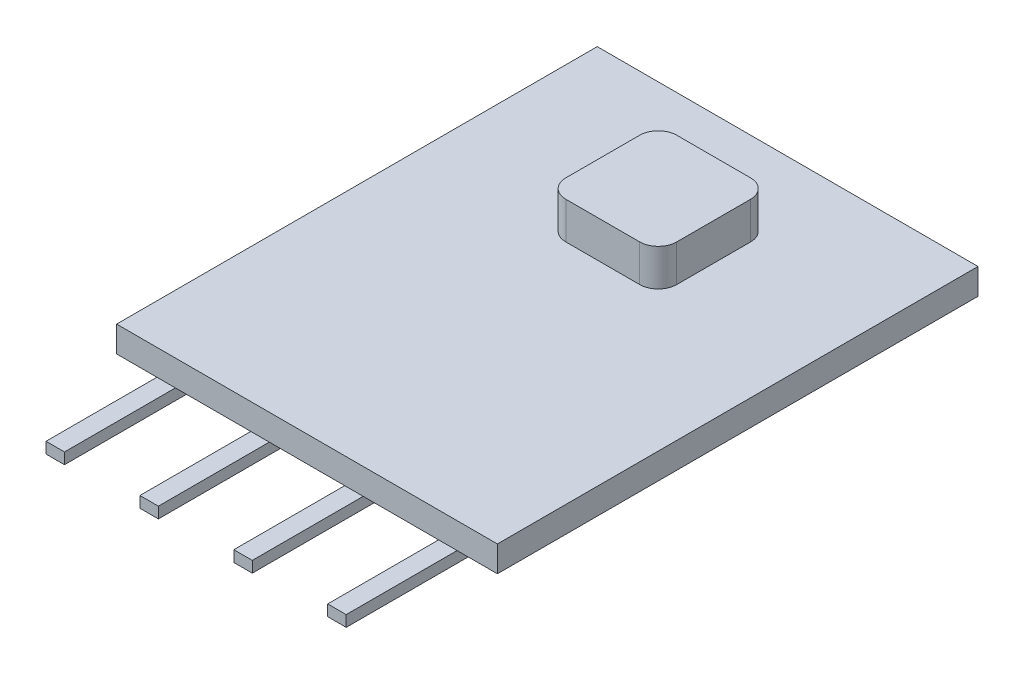
from build123d import *

# Parameters (mm, degrees)
SKETCH_1_W             = 10.3
SKETCH_1_H             = 13
EXTRUDE_1_DEPTH        = 0.7
SKETCH_2_W             = 3
SKETCH_2_H             = 3
EXTRUDE_2_DEPTH        = 1
FILLET_1_R             = 0.5
SKETCH_3_W             = 0.5
SKETCH_3_H             = 0.5
EXTRUDE_3_DEPTH        = 0.3
SKETCH_4_W             = 0.5
SKETCH_4_H             = 0.3
EXTRUDE_4_DEPTH        = 3
PATTERN_LINEAR_1_COUNT = 4
PATTERN_LINEAR_1_PITCH = 2.54


with BuildPart() as part:
    # Эскиз1 → Бобышка-Вытянуть1 (new body)
    with BuildSketch(Plane(origin=(0, 0, 0), x_dir=(1, 0, 0), z_dir=(0, 1, 0))):
        Rectangle(SKETCH_1_W, SKETCH_1_H)
    extrude(amount=EXTRUDE_1_DEPTH)



with BuildPart() as body_2:
    # Эскиз2 → Бобышка-Вытянуть2 (new body)
    with BuildSketch(Plane(origin=(0, 0.7, 0), x_dir=(1, 0, 0), z_dir=(0, 1, 0))):
        with Locations((0, 3)):
            Rectangle(SKETCH_2_W, SKETCH_2_H)
    extrude(amount=EXTRUDE_2_DEPTH)

    # Скругление1
    fillet_1_edges = [body_2.edges().sort_by_distance(p)[0] for p in [
        (1.5, 1.2, -1.5),
        (-1.5, 1.2, -1.5),
        (-1.5, 1.2, -4.5),
        (1.5, 1.2, -4.5),
    ]]
    fillet(fillet_1_edges, radius=FILLET_1_R)


with BuildPart() as body_3:
    # Эскиз3 → Бобышка-Вытянуть3 (new body)
    with BuildSketch(Plane.XZ):
        with Locations((-3.81, 6.25)):
            Rectangle(SKETCH_3_W, SKETCH_3_H)
    extrude_3 = extrude(amount=EXTRUDE_3_DEPTH)


with BuildPart() as part_1:
    add(part.part)

    add(body_3.part)  # Бобышка-Вытянуть4 merges body 3
    # Эскиз4 → Бобышка-Вытянуть4 (add)
    with BuildSketch(Plane.XY.offset(6.5)):
        with Locations((-3.81, -0.15)):
            Rectangle(SKETCH_4_W, SKETCH_4_H)
    extrude_4 = extrude(amount=EXTRUDE_4_DEPTH)

    # Линейный массив1: Бобышка-Вытянуть3, Бобышка-Вытянуть4 ×4
    with Locations(*[(i * PATTERN_LINEAR_1_PITCH, 0, 0) for i in range(1, PATTERN_LINEAR_1_COUNT)]):
        add(extrude_3)
        add(extrude_4)


solid = Compound([body_2.part, part_1.part])
